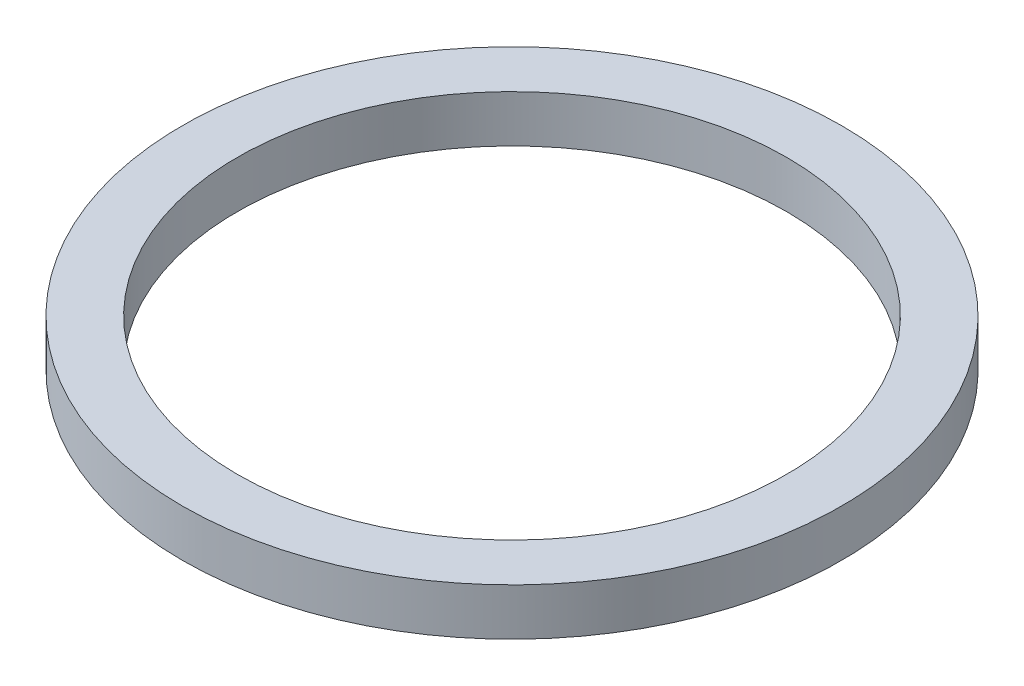
from build123d import *

# Parameters (mm, degrees)
SKETCH1_R           = 10.5
SKETCH1_R_2         = 8.75
BOSS_EXTRUDE1_DEPTH = 1.5


with BuildPart() as part:
    # Sketch1 → Boss-Extrude1 (new body)
    with BuildSketch(Plane(origin=(0, 0, 0), x_dir=(1, 0, 0), z_dir=(0, 1, 0))):
        with Locations(Location((0, 0, 0), (0, 0, 270))):
            Circle(SKETCH1_R)
        with Locations(Location((0, 0, 0), (0, 0, 270))):
            Circle(SKETCH1_R_2, mode=Mode.SUBTRACT)
    extrude(amount=BOSS_EXTRUDE1_DEPTH)


solid = part.part
